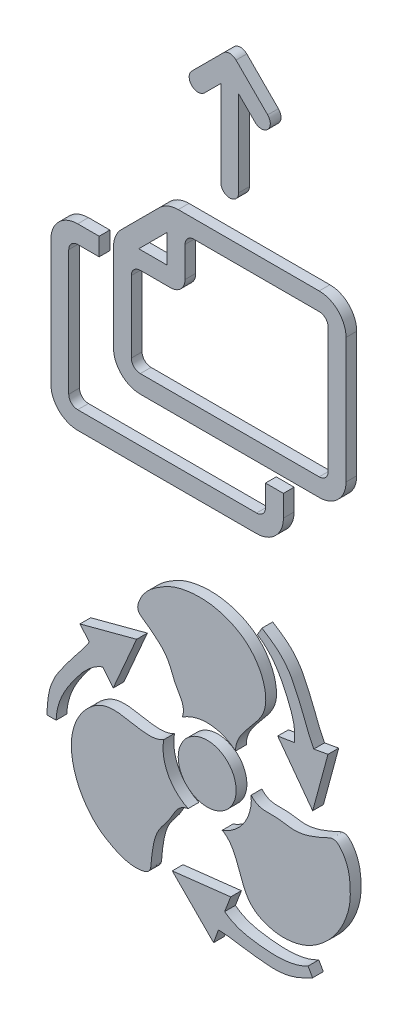
from build123d import *

# Parameters (mm, degrees)
ESQUISSE1_R           = 1.62
BOSS_EXTRU_1_DEPTH    = 0.6
BOSS_EXTRU_1_2_DEPTH  = 0.6
BOSS_EXTRU_1_3_DEPTH  = 0.6
BOSS_EXTRU_1_4_DEPTH  = 0.6
BOSS_EXTRU_1_5_DEPTH  = 0.6
BOSS_EXTRU_1_6_DEPTH  = 0.6
BOSS_EXTRU_1_7_DEPTH  = 0.6
BOSS_EXTRU_1_8_DEPTH  = 0.6
BOSS_EXTRU_1_9_DEPTH  = 0.6
BOSS_EXTRU_1_10_DEPTH = 0.6


with BuildPart() as part:
    # Esquisse1 → Boss.-Extru.1 (new body)
    with BuildSketch(Plane.XY):
        with Locations(Location((72.964561417, -10, 0), (0, 0, 180))):
            Circle(ESQUISSE1_R)
    extrude(amount=BOSS_EXTRU_1_DEPTH)


with BuildPart() as body_2:
    # Esquisse1 → Boss.-Extru.1 2 (new body)
    with BuildSketch(Plane.XY):
        with BuildLine():
            Line((65.851591958, -6.307623742), (66.375435127, -6.925042134))
            add(Edge.make_bspline(
                [(66.375435127, -6.925042134), (66.071631158, -7.423393388), (65.519052829, -8.025592719), (64.881229755, -8.915275939), (64.392931193, -9.604447744), (64.053624701, -10.549482878), (64.018284884, -11.259500196), (64.008863413, -11.636233421)],
                knots=[0, 0, 0, 0, 0.322858089, 0.451825963, 0.608227628, 0.790300876, 1, 1, 1, 1], degree=3))
            Line((64.008863413, -11.636233421), (64.519520145, -11.636233421))
            add(Edge.make_bspline(
                [(64.519520145, -11.636233421), (64.533626408, -11.057078803), (64.837659385, -10.177724816), (65.746586156, -8.841191084), (66.428240115, -8.02508512), (67.115612365, -7.75285457)],
                knots=[0, 0, 0, 0, 0.353975151, 0.561821238, 1, 1, 1, 1], degree=3))
            Line((67.115612365, -7.75285457), (67.709549665, -8.483854324))
            Line((67.709549665, -8.483854324), (69.019257556, -5.467435813))
            Line((69.019257556, -5.467435813), (65.851591958, -6.307623742))
        make_face()
    extrude(amount=BOSS_EXTRU_1_2_DEPTH)


with BuildPart() as body_3:
    # Esquisse1 → Boss.-Extru.1 3 (new body)
    with BuildSketch(Plane.XY):
        with BuildLine():
            Line((73.323354506, -18.006200377), (73.596132935, -17.243829689))
            add(Edge.make_bspline(
                [(73.596132935, -17.243829689), (74.179619765, -17.257756017), (74.977428848, -17.435203222), (76.066828655, -17.542732597), (76.907818227, -17.621025654), (77.895895906, -17.442356128), (78.52845885, -17.117952649), (78.859430128, -16.937745269)],
                knots=[0, 0, 0, 0, 0.322858089, 0.451825963, 0.608227628, 0.790300876, 1, 1, 1, 1], degree=3))
            Line((78.859430128, -16.937745269), (78.604101763, -16.495503567))
            add(Edge.make_bspline(
                [(78.604101763, -16.495503567), (78.095486019, -16.772864494), (77.181926639, -16.949241206), (75.569991088, -16.830354398), (74.522395612, -16.648077735), (73.942950915, -16.188911179)],
                knots=[0, 0, 0, 0, 0.353975151, 0.561821238, 1, 1, 1, 1], degree=3))
            Line((73.942950915, -16.188911179), (74.279046622, -15.309046513))
            Line((74.279046622, -15.309046513), (71.011897618, -15.683015462))
            Line((71.011897618, -15.683015462), (73.323354506, -18.006200377))
        make_face()
    extrude(amount=BOSS_EXTRU_1_3_DEPTH)


with BuildPart() as body_4:
    # Esquisse1 → Boss.-Extru.1 4 (new body)
    with BuildSketch(Plane.XY):
        with BuildLine():
            Line((79.718737786, -5.686175882), (78.922116189, -5.831128177))
            add(Edge.make_bspline(
                [(78.922116189, -5.831128177), (78.642433328, -5.318850595), (78.397202574, -4.539204059), (77.945625841, -3.541991464), (77.592934831, -2.774526602), (76.944163643, -2.008160994), (76.346940518, -1.622547155), (76.025390709, -1.42602131)],
                knots=[0, 0, 0, 0, 0.322858089, 0.451825963, 0.608227628, 0.790300876, 1, 1, 1, 1], degree=3))
            Line((76.025390709, -1.42602131), (75.770062344, -1.868263012))
            add(Edge.make_bspline(
                [(75.770062344, -1.868263012), (76.264571824, -2.170056703), (76.874098227, -2.873033978), (77.577107007, -4.328454518), (77.943048524, -5.326837145), (77.835120971, -6.05823425)],
                knots=[0, 0, 0, 0, 0.353975151, 0.561821238, 1, 1, 1, 1], degree=3))
            Line((77.835120971, -6.05823425), (76.905087965, -6.207099163))
            Line((76.905087965, -6.207099163), (78.862529077, -8.849548724))
            Line((78.862529077, -8.849548724), (79.718737786, -5.686175882))
        make_face()
    extrude(amount=BOSS_EXTRU_1_4_DEPTH)


with BuildPart() as body_5:
    # Esquisse1 → Boss.-Extru.1 5 (new body)
    with BuildSketch(Plane.XY):
        with BuildLine():
            Line((72.811183182, 22.878679656), (73.725396744, 23.792893219))
            Line((73.725396744, 23.792893219), (73.725396744, 19))
            ThreePointArc((73.725396744, 19), (74.225396744, 18.5), (74.725396744, 19))
            Line((74.725396744, 19), (74.725396744, 23.792893219))
            Line((74.725396744, 23.792893219), (75.639610307, 22.878679656))
            ThreePointArc((75.639610307, 22.878679656), (76.346717088, 22.878679656), (76.346717088, 23.585786438))
            Line((76.346717088, 23.585786438), (74.578950135, 25.353553391))
            ThreePointArc((74.578950135, 25.353553391), (74.225396744, 25.5), (73.871843354, 25.353553391))
            Line((73.871843354, 25.353553391), (72.104076401, 23.585786438))
            ThreePointArc((72.104076401, 23.585786438), (72.104076401, 22.878679656), (72.811183182, 22.878679656))
        make_face()
    extrude(amount=BOSS_EXTRU_1_5_DEPTH)


with BuildPart() as body_6:
    # Esquisse1 → Boss.-Extru.1 6 (new body)
    with BuildSketch(Plane.XY):
        with BuildLine():
            Line((69.225396744, 6.5), (79.225396744, 6.5))
            ThreePointArc((79.225396744, 6.5), (80.286056916, 6.939339828), (80.725396744, 8))
            Line((80.725396744, 8), (80.725396744, 15))
            ThreePointArc((80.725396744, 15), (80.286056916, 16.060660172), (79.225396744, 16.5))
            Line((79.225396744, 16.5), (71.346717088, 16.5))
            ThreePointArc((71.346717088, 16.5), (70.772691939, 16.385819299), (70.286056916, 16.060660172))
            Line((70.286056916, 16.060660172), (68.164736573, 13.939339828))
            ThreePointArc((68.164736573, 13.939339828), (67.839577446, 13.452704805), (67.725396744, 12.878679656))
            Line((67.725396744, 12.878679656), (67.725396744, 8))
            ThreePointArc((67.725396744, 8), (68.164736573, 6.939339828), (69.225396744, 6.5))
        make_face()
        with BuildLine():
            Line((68.725396744, 12), (68.725396744, 8))
            ThreePointArc((68.725396744, 8), (68.871843354, 7.646446609), (69.225396744, 7.5))
            Line((69.225396744, 7.5), (79.225396744, 7.5))
            ThreePointArc((79.225396744, 7.5), (79.578950135, 7.646446609), (79.725396744, 8))
            Line((79.725396744, 8), (79.725396744, 15))
            ThreePointArc((79.725396744, 15), (79.578950135, 15.353553391), (79.225396744, 15.5))
            Line((79.225396744, 15.5), (72.225396744, 15.5))
            ThreePointArc((72.225396744, 15.5), (71.871843354, 15.353553391), (71.725396744, 15))
            Line((71.725396744, 15), (71.725396744, 13.3))
            ThreePointArc((71.725396744, 13.3), (71.491082169, 12.734314575), (70.925396744, 12.5))
            Line((70.925396744, 12.5), (69.225396744, 12.5))
            ThreePointArc((69.225396744, 12.5), (68.871843354, 12.353553391), (68.725396744, 12))
        make_face(mode=Mode.SUBTRACT)
        Polygon((69.139610307, 13.5), (70.725396744, 13.5), (70.725396744, 15.085786438), align=None, mode=Mode.SUBTRACT)
    extrude(amount=BOSS_EXTRU_1_6_DEPTH)


with BuildPart() as body_7:
    # Esquisse1 → Boss.-Extru.1 7 (new body)
    with BuildSketch(Plane.XY):
        with BuildLine():
            Line((65.225396744, 4.5), (65.225396744, 11.5))
            ThreePointArc((65.225396744, 11.5), (65.371843354, 11.853553391), (65.725396744, 12))
            Line((65.725396744, 12), (66.925396744, 12))
            Line((66.925396744, 12), (66.925396744, 13))
            Line((66.925396744, 13), (65.725396744, 13))
            ThreePointArc((65.725396744, 13), (64.664736573, 12.560660172), (64.225396744, 11.5))
            Line((64.225396744, 11.5), (64.225396744, 4.5))
            ThreePointArc((64.225396744, 4.5), (64.664736573, 3.439339828), (65.725396744, 3))
            Line((65.725396744, 3), (75.725396744, 3))
            ThreePointArc((75.725396744, 3), (76.786056916, 3.439339828), (77.225396744, 4.5))
            Line((77.225396744, 4.5), (77.225396744, 5.7))
            Line((77.225396744, 5.7), (76.225396744, 5.7))
            Line((76.225396744, 5.7), (76.225396744, 4.5))
            ThreePointArc((76.225396744, 4.5), (76.078950135, 4.146446609), (75.725396744, 4))
            Line((75.725396744, 4), (65.725396744, 4))
            ThreePointArc((65.725396744, 4), (65.371843354, 4.146446609), (65.225396744, 4.5))
        make_face()
    extrude(amount=BOSS_EXTRU_1_7_DEPTH)


with BuildPart() as body_8:
    # Esquisse1 → Boss.-Extru.1 8 (new body)
    with BuildSketch(Plane.XY):
        with BuildLine():
            ThreePointArc((70.535753886, -9.569287537), (70.770394602, -11.127054229), (71.899955596, -12.225136781))
            add(Edge.make_bspline(
                [(70.535753886, -9.569287537), (69.585840668, -10.132331882), (67.955654744, -9.082168097), (66.352200801, -10.023756827), (65.698844179, -10.855603196), (65.350776009, -11.908414111), (65.367861724, -12.981673121), (65.67197203, -14.103635192), (66.248491555, -15.045526926), (66.926177962, -15.747593471), (67.591521269, -16.146009975), (68.203488253, -16.440629284), (68.808652285, -16.560639208), (69.287976102, -16.538697367), (69.660267086, -16.430002078), (69.825370363, -16.157240214), (69.820157615, -15.798811375), (69.901813919, -15.299584036), (69.994621423, -14.64848489), (70.282964525, -13.949355119), (71.034251166, -13.18566963), (71.234044366, -12.340652079), (71.899955596, -12.225136781)],
                knots=[0, 0, 0, 0, 0.177515374, 0.224651833, 0.289488625, 0.345336008, 0.400887181, 0.46102568, 0.531695868, 0.577425535, 0.617678532, 0.656656085, 0.687063506, 0.716130115, 0.73507333, 0.745883758, 0.765115099, 0.79185348, 0.828117498, 0.871557477, 0.911340093, 1, 1, 1, 1], degree=3))
        make_face()
    extrude(amount=BOSS_EXTRU_1_8_DEPTH)


with BuildPart() as body_9:
    # Esquisse1 → Boss.-Extru.1 9 (new body)
    with BuildSketch(Plane.XY):
        with BuildLine():
            ThreePointArc((74.551973118, -8.111947209), (73.085587231, -7.536268683), (71.569839348, -7.965455924))
            add(Edge.make_bspline(
                [(74.551973118, -8.111947209), (74.53931902, -7.007776059), (76.263880498, -6.121075527), (76.250167709, -4.261649314), (75.856445932, -3.279902697), (75.11871902, -2.452061363), (74.180706595, -1.930228521), (73.057003787, -1.632614736), (71.953041855, -1.660949422), (71.006191188, -1.896809795), (70.32848072, -2.273805749), (69.767349422, -2.656475049), (69.360835764, -3.120557512), (69.140176048, -3.546635034), (69.048163437, -3.923396129), (69.201830501, -4.202760693), (69.514845355, -4.37746074), (69.906360762, -4.697790843), (70.42382541, -5.103714073), (70.885118002, -5.702991409), (71.170845715, -6.735467471), (71.80275578, -7.331002233), (71.569839348, -7.965455924)],
                knots=[0, 0, 0, 0, 0.177515374, 0.224651833, 0.289488625, 0.345336008, 0.400887181, 0.46102568, 0.531695868, 0.577425535, 0.617678532, 0.656656085, 0.687063506, 0.716130115, 0.73507333, 0.745883758, 0.765115099, 0.79185348, 0.828117498, 0.871557477, 0.911340093, 1, 1, 1, 1], degree=3))
        make_face()
    extrude(amount=BOSS_EXTRU_1_9_DEPTH)


with BuildPart() as body_10:
    # Esquisse1 → Boss.-Extru.1 10 (new body)
    with BuildSketch(Plane.XY):
        with BuildLine():
            ThreePointArc((73.805957248, -12.318765255), (75.037702418, -11.336677088), (75.423889307, -9.809407295))
            add(Edge.make_bspline(
                [(73.805957248, -12.318765255), (74.768524563, -12.85989206), (74.67414901, -14.796756375), (76.291315741, -15.714593859), (77.338394139, -15.864494106), (78.424189222, -15.639524526), (79.345115932, -15.088098358), (80.164708434, -14.263750073), (80.692150842, -13.293523651), (80.961315101, -12.355596734), (80.973682261, -11.580184276), (80.922846575, -10.902895667), (80.724196202, -10.318803281), (80.465532102, -9.914667599), (80.185253728, -9.646601793), (79.866483387, -9.639999093), (79.558681281, -9.823727885), (79.085509571, -10.002625121), (78.475237417, -10.247801037), (77.725601724, -10.347653472), (76.68858737, -10.0788629), (75.856884104, -10.328345688), (75.423889307, -9.809407295)],
                knots=[0, 0, 0, 0, 0.177515374, 0.224651833, 0.289488625, 0.345336008, 0.400887181, 0.46102568, 0.531695868, 0.577425535, 0.617678532, 0.656656085, 0.687063506, 0.716130115, 0.73507333, 0.745883758, 0.765115099, 0.79185348, 0.828117498, 0.871557477, 0.911340093, 1, 1, 1, 1], degree=3))
        make_face()
    extrude(amount=BOSS_EXTRU_1_10_DEPTH)


solid = Compound([part.part, body_2.part, body_3.part, body_4.part, body_5.part, body_6.part, body_7.part, body_8.part, body_9.part, body_10.part])
